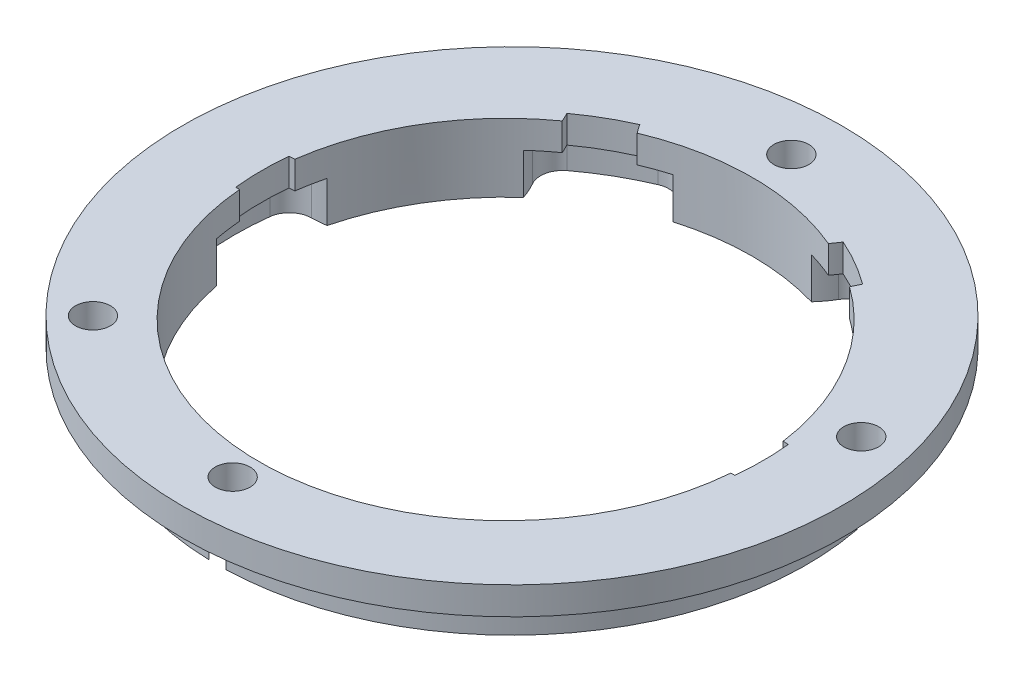
from build123d import *

# Parameters (mm, degrees)
SKETCH1_R           = 6.35
BOSS_EXTRUDE1_DEPTH = 9.652
FILLET1_R           = 2.54
SKETCH2_R           = 33.75
BOSS_EXTRUDE2_DEPTH = 9.652
CUT_EXTRUDE1_DEPTH  = 49.695853067
SKETCH4_R           = 37.75
SKETCH4_R_2         = 33.75
BOSS_EXTRUDE3_DEPTH = 3.175
BOSS_EXTRUDE4_DEPTH = 3.15
CUT_EXTRUDE2_DEPTH  = 61.228214281
SKETCH6_R           = 28.231147361
CUT_EXTRUDE3_DEPTH  = 61.228214281
CUT_EXTRUDE5_DEPTH  = 5


with BuildPart() as part:
    # Sketch1 → Boss-Extrude1 (new body)
    with BuildSketch(Plane(origin=(0, 0, 0), x_dir=(1, 0, 0), z_dir=(0, 1, 0))):
        with BuildLine():
            ThreePointArc((-10.16, 30.080506977), (0, 22.86), (10.16, 30.080506977))
            ThreePointArc((10.16, 30.080506977), (15.875, 27.49630657), (20.970483201, 23.839071591))
            ThreePointArc((20.970483201, 23.839071591), (19.797340731, 11.43), (31.130483201, 6.241435386))
            ThreePointArc((31.130483201, 6.241435386), (31.75, 0), (31.130483201, -6.241435386))
            ThreePointArc((31.130483201, -6.241435386), (19.797340731, -11.43), (20.970483201, -23.839071591))
            ThreePointArc((20.970483201, -23.839071591), (15.875, -27.49630657), (10.16, -30.080506977))
            ThreePointArc((10.16, -30.080506977), (0, -22.86), (-10.16, -30.080506977))
            ThreePointArc((-10.16, -30.080506977), (-15.875, -27.49630657), (-20.970483201, -23.839071591))
            ThreePointArc((-20.970483201, -23.839071591), (-19.797340731, -11.43), (-31.130483201, -6.241435386))
            ThreePointArc((-31.130483201, -6.241435386), (-31.75, 0), (-31.130483201, 6.241435386))
            ThreePointArc((-31.130483201, 6.241435386), (-19.797340731, 11.43), (-20.970483201, 23.839071591))
            ThreePointArc((-20.970483201, 23.839071591), (-15.875, 27.49630657), (-10.16, 30.080506977))
        make_face()
        with Locations(Location((0, 0, 0), (0, 0, 270))):
            Circle(SKETCH1_R, mode=Mode.SUBTRACT)
    extrude(amount=BOSS_EXTRUDE1_DEPTH)

    # Fillet1
    fillet1_edges = [part.edges().sort_by_distance(p)[0] for p in [
        (-10.16, 4.826, -30.080506977),
        (10.16, 4.826, -30.080506977),
        (20.970483201, 4.826, -23.839071591),
        (31.130483201, 4.826, -6.241435386),
        (31.130483201, 4.826, 6.241435386),
        (20.970483201, 4.826, 23.839071591),
        (10.16, 4.826, 30.080506977),
        (-10.16, 4.826, 30.080506977),
        (-20.970483201, 4.826, 23.839071591),
        (-31.130483201, 4.826, 6.241435386),
        (-31.130483201, 4.826, -6.241435386),
        (-20.970483201, 4.826, -23.839071591),
    ]]
    fillet(fillet1_edges, radius=FILLET1_R)

    # Sketch3 → Cut-Extrude1 (cut, through all)
    with BuildSketch(Plane(origin=(0, 9.652, 0), x_dir=(1, 0, 0), z_dir=(0, 1, 0))):
        with BuildLine():
            ThreePointArc((12.454547411, -29.205252076), (15.875, -27.49630657), (19.065216516, -25.388580488))
            ThreePointArc((19.065216516, -25.388580488), (20.026339499, -23.876831986), (19.750712464, -22.106755531))
            ThreePointArc((19.750712464, -22.106755531), (19.797340731, -11.43), (29.020368117, -6.051240971))
            ThreePointArc((29.020368117, -6.051240971), (30.691112811, -5.404902757), (31.519763927, -3.816671587))
            ThreePointArc((31.519763927, -3.816671587), (31.75, 0), (31.519763927, 3.816671587))
            ThreePointArc((31.519763927, 3.816671587), (30.691112811, 5.404902757), (29.020368117, 6.051240971))
            ThreePointArc((29.020368117, 6.051240971), (19.797340731, 11.43), (19.750712464, 22.106755531))
            ThreePointArc((19.750712464, 22.106755531), (20.026339499, 23.876831986), (19.065216516, 25.388580488))
            ThreePointArc((19.065216516, 25.388580488), (15.875, 27.49630657), (12.454547411, 29.205252076))
            ThreePointArc((12.454547411, 29.205252076), (10.664773313, 29.281734744), (9.269655653, 28.157996502))
            ThreePointArc((9.269655653, 28.157996502), (0, 22.86), (-9.269655653, 28.157996502))
            ThreePointArc((-9.269655653, 28.157996502), (-10.664773313, 29.281734744), (-12.454547411, 29.205252076))
            ThreePointArc((-12.454547411, 29.205252076), (-15.875, 27.49630657), (-19.065216516, 25.388580488))
            ThreePointArc((-19.065216516, 25.388580488), (-20.026339499, 23.876831986), (-19.750712464, 22.106755531))
            ThreePointArc((-19.750712464, 22.106755531), (-19.797340731, 11.43), (-29.020368117, 6.051240971))
            ThreePointArc((-29.020368117, 6.051240971), (-30.691112811, 5.404902757), (-31.519763927, 3.816671587))
            ThreePointArc((-31.519763927, 3.816671587), (-31.75, 0), (-31.519763927, -3.816671587))
            ThreePointArc((-31.519763927, -3.816671587), (-30.691112811, -5.404902757), (-29.020368117, -6.051240971))
            ThreePointArc((-29.020368117, -6.051240971), (-19.797340731, -11.43), (-19.750712464, -22.106755531))
            ThreePointArc((-19.750712464, -22.106755531), (-20.026339499, -23.876831986), (-19.065216516, -25.388580488))
            ThreePointArc((-19.065216516, -25.388580488), (-15.875, -27.49630657), (-12.454547411, -29.205252076))
            ThreePointArc((-12.454547411, -29.205252076), (-10.664773313, -29.281734744), (-9.269655653, -28.157996502))
            ThreePointArc((-9.269655653, -28.157996502), (0, -22.86), (9.269655653, -28.157996502))
            ThreePointArc((9.269655653, -28.157996502), (10.664773313, -29.281734744), (12.454547411, -29.205252076))
        make_face()
    extrude(amount=-CUT_EXTRUDE1_DEPTH, mode=Mode.SUBTRACT)


with BuildPart() as body_2:
    # Sketch2 → Boss-Extrude2 (new, through all)
    with BuildSketch(Plane.XZ):
        with Locations(Location((0, 0, 0), (0, 0, 270))):
            Circle(SKETCH2_R)
        with BuildLine():
            ThreePointArc((19.750712464, 22.106755531), (19.797340731, 11.43), (29.020368117, 6.051240971))
            ThreePointArc((29.020368117, 6.051240971), (30.691112811, 5.404902757), (31.519763927, 3.816671587))
            ThreePointArc((31.519763927, 3.816671587), (31.75, 0), (31.519763927, -3.816671587))
            ThreePointArc((31.519763927, -3.816671587), (30.691112811, -5.404902757), (29.020368117, -6.051240971))
            ThreePointArc((29.020368117, -6.051240971), (19.797340731, -11.43), (19.750712464, -22.106755531))
            ThreePointArc((19.750712464, -22.106755531), (20.026339499, -23.876831986), (19.065216516, -25.388580488))
            ThreePointArc((19.065216516, -25.388580488), (15.875, -27.49630657), (12.454547411, -29.205252076))
            ThreePointArc((12.454547411, -29.205252076), (10.664773313, -29.281734744), (9.269655653, -28.157996502))
            ThreePointArc((9.269655653, -28.157996502), (0, -22.86), (-9.269655653, -28.157996502))
            ThreePointArc((-9.269655653, -28.157996502), (-10.664773313, -29.281734744), (-12.454547411, -29.205252076))
            ThreePointArc((-12.454547411, -29.205252076), (-15.875, -27.49630657), (-19.065216516, -25.388580488))
            ThreePointArc((-19.065216516, -25.388580488), (-20.026339499, -23.876831986), (-19.750712464, -22.106755531))
            ThreePointArc((-19.750712464, -22.106755531), (-19.797340731, -11.43), (-29.020368117, -6.051240971))
            ThreePointArc((-29.020368117, -6.051240971), (-30.691112811, -5.404902757), (-31.519763927, -3.816671587))
            ThreePointArc((-31.519763927, -3.816671587), (-31.75, 0), (-31.519763927, 3.816671587))
            ThreePointArc((-31.519763927, 3.816671587), (-30.691112811, 5.404902757), (-29.020368117, 6.051240971))
            ThreePointArc((-29.020368117, 6.051240971), (-19.797340731, 11.43), (-19.750712464, 22.106755531))
            ThreePointArc((-19.750712464, 22.106755531), (-20.026339499, 23.876831986), (-19.065216516, 25.388580488))
            ThreePointArc((-19.065216516, 25.388580488), (-15.875, 27.49630657), (-12.454547411, 29.205252076))
            ThreePointArc((-12.454547411, 29.205252076), (-10.664773313, 29.281734744), (-9.269655653, 28.157996502))
            ThreePointArc((-9.269655653, 28.157996502), (0, 22.86), (9.269655653, 28.157996502))
            ThreePointArc((9.269655653, 28.157996502), (10.664773313, 29.281734744), (12.454547411, 29.205252076))
            ThreePointArc((12.454547411, 29.205252076), (15.875, 27.49630657), (19.065216516, 25.388580488))
            ThreePointArc((19.065216516, 25.388580488), (20.026339499, 23.876831986), (19.750712464, 22.106755531))
        make_face(mode=Mode.SUBTRACT)
    extrude(amount=-BOSS_EXTRUDE2_DEPTH)

    # Sketch4 → Boss-Extrude3 (add)
    # profile 1 of 2: a face of its own
    with BuildSketch(Plane(origin=(0, 9.652, 0), x_dir=(1, 0, 0), z_dir=(0, 1, 0))):
        with Locations(Location((0, 0, 0), (0, 0, 270))):
            Circle(SKETCH4_R)
        with Locations(Location((0, 0, 0), (0, 0, 90))):
            Circle(SKETCH4_R_2, mode=Mode.SUBTRACT)
    # profile 2 of 2: a face of its own
    with BuildSketch(Plane(origin=(0, 9.652, 0), x_dir=(1, 0, 0), z_dir=(0, 1, 0))):
        with Locations(Location((0, 0, 0), (0, 0, 90))):
            Circle(SKETCH4_R_2)
        with BuildLine():
            ThreePointArc((31.519763927, -3.816671587), (30.691112811, -5.404902757), (29.020368117, -6.051240971))
            ThreePointArc((29.020368117, -6.051240971), (19.797340731, -11.43), (19.750712464, -22.106755531))
            ThreePointArc((19.750712464, -22.106755531), (20.026339499, -23.876831986), (19.065216516, -25.388580488))
            ThreePointArc((19.065216516, -25.388580488), (15.875, -27.49630657), (12.454547411, -29.205252076))
            ThreePointArc((12.454547411, -29.205252076), (10.664773313, -29.281734744), (9.269655653, -28.157996502))
            ThreePointArc((9.269655653, -28.157996502), (0, -22.86), (-9.269655653, -28.157996502))
            ThreePointArc((-9.269655653, -28.157996502), (-10.664773313, -29.281734744), (-12.454547411, -29.205252076))
            ThreePointArc((-12.454547411, -29.205252076), (-15.875, -27.49630657), (-19.065216516, -25.388580488))
            ThreePointArc((-19.065216516, -25.388580488), (-20.026339499, -23.876831986), (-19.750712464, -22.106755531))
            ThreePointArc((-19.750712464, -22.106755531), (-19.797340731, -11.43), (-29.020368117, -6.051240971))
            ThreePointArc((-29.020368117, -6.051240971), (-30.691112811, -5.404902757), (-31.519763927, -3.816671587))
            ThreePointArc((-31.519763927, -3.816671587), (-31.75, 0), (-31.519763927, 3.816671587))
            ThreePointArc((-31.519763927, 3.816671587), (-30.691112811, 5.404902757), (-29.020368117, 6.051240971))
            ThreePointArc((-29.020368117, 6.051240971), (-19.797340731, 11.43), (-19.750712464, 22.106755531))
            ThreePointArc((-19.750712464, 22.106755531), (-20.026339499, 23.876831986), (-19.065216516, 25.388580488))
            ThreePointArc((-19.065216516, 25.388580488), (-15.875, 27.49630657), (-12.454547411, 29.205252076))
            ThreePointArc((-12.454547411, 29.205252076), (-10.664773313, 29.281734744), (-9.269655653, 28.157996502))
            ThreePointArc((-9.269655653, 28.157996502), (0, 22.86), (9.269655653, 28.157996502))
            ThreePointArc((9.269655653, 28.157996502), (10.664773313, 29.281734744), (12.454547411, 29.205252076))
            ThreePointArc((12.454547411, 29.205252076), (15.875, 27.49630657), (19.065216516, 25.388580488))
            ThreePointArc((19.065216516, 25.388580488), (20.026339499, 23.876831986), (19.750712464, 22.106755531))
            ThreePointArc((19.750712464, 22.106755531), (19.797340731, 11.43), (29.020368117, 6.051240971))
            ThreePointArc((29.020368117, 6.051240971), (30.691112811, 5.404902757), (31.519763927, 3.816671587))
            ThreePointArc((31.519763927, 3.816671587), (31.75, 0), (31.519763927, -3.816671587))
        make_face(mode=Mode.SUBTRACT)
    extrude(amount=BOSS_EXTRUDE3_DEPTH)

    # Sketch9 → Boss-Extrude4 (add)
    with BuildSketch(Plane(origin=(0, 12.827, 0), x_dir=(1, 0, 0), z_dir=(0, 1, 0))):
        with BuildLine():
            ThreePointArc((-19.065216516, 25.388580488), (-20.026339499, 23.876831986), (-19.750712464, 22.106755531))
            ThreePointArc((-19.750712464, 22.106755531), (-19.797340731, 11.43), (-29.020368117, 6.051240971))
            ThreePointArc((-29.020368117, 6.051240971), (-30.691112811, 5.404902757), (-31.519763927, 3.816671587))
            ThreePointArc((-31.519763927, 3.816671587), (-31.75, 0), (-31.519763927, -3.816671587))
            ThreePointArc((-31.519763927, -3.816671587), (-30.691112811, -5.404902757), (-29.020368117, -6.051240971))
            ThreePointArc((-29.020368117, -6.051240971), (-19.797340731, -11.43), (-19.750712464, -22.106755531))
            ThreePointArc((-19.750712464, -22.106755531), (-20.026339499, -23.876831986), (-19.065216516, -25.388580488))
            ThreePointArc((-19.065216516, -25.388580488), (-15.875, -27.49630657), (-12.454547411, -29.205252076))
            ThreePointArc((-12.454547411, -29.205252076), (-10.664773313, -29.281734744), (-9.269655653, -28.157996502))
            ThreePointArc((-9.269655653, -28.157996502), (0, -22.86), (9.269655653, -28.157996502))
            ThreePointArc((9.269655653, -28.157996502), (10.664773313, -29.281734744), (12.454547411, -29.205252076))
            ThreePointArc((12.454547411, -29.205252076), (15.875, -27.49630657), (19.065216516, -25.388580488))
            ThreePointArc((19.065216516, -25.388580488), (20.026339499, -23.876831986), (19.750712464, -22.106755531))
            ThreePointArc((19.750712464, -22.106755531), (19.797340731, -11.43), (29.020368117, -6.051240971))
            ThreePointArc((29.020368117, -6.051240971), (30.691112811, -5.404902757), (31.519763927, -3.816671587))
            ThreePointArc((31.519763927, -3.816671587), (31.75, 0), (31.519763927, 3.816671587))
            ThreePointArc((31.519763927, 3.816671587), (30.691112811, 5.404902757), (29.020368117, 6.051240971))
            ThreePointArc((29.020368117, 6.051240971), (19.797340731, 11.43), (19.750712464, 22.106755531))
            ThreePointArc((19.750712464, 22.106755531), (20.026339499, 23.876831986), (19.065216516, 25.388580488))
            ThreePointArc((19.065216516, 25.388580488), (15.875, 27.49630657), (12.454547411, 29.205252076))
            ThreePointArc((12.454547411, 29.205252076), (10.664773313, 29.281734744), (9.269655653, 28.157996502))
            ThreePointArc((9.269655653, 28.157996502), (0, 22.86), (-9.269655653, 28.157996502))
            ThreePointArc((-9.269655653, 28.157996502), (-10.664773313, 29.281734744), (-12.454547411, 29.205252076))
            ThreePointArc((-12.454547411, 29.205252076), (-15.875, 27.49630657), (-19.065216516, 25.388580488))
        make_face()
        with BuildLine():
            ThreePointArc((-28.586588604, 3.060956059), (-17.199264519, 9.93), (-16.944160009, 23.226233909))
            ThreePointArc((-16.944160009, 23.226233909), (-14.375, 24.898230359), (-11.642428595, 26.287189968))
            ThreePointArc((-11.642428595, 26.287189968), (0, 19.86), (11.642428595, 26.287189968))
            ThreePointArc((11.642428595, 26.287189968), (14.375, 24.898230359), (16.944160009, 23.226233909))
            ThreePointArc((16.944160009, 23.226233909), (17.199264519, 9.93), (28.586588604, 3.060956059))
            ThreePointArc((28.586588604, 3.060956059), (28.75, 0), (28.586588604, -3.060956059))
            ThreePointArc((28.586588604, -3.060956059), (17.199264519, -9.93), (16.944160009, -23.226233909))
            ThreePointArc((16.944160009, -23.226233909), (14.375, -24.898230359), (11.642428595, -26.287189968))
            ThreePointArc((11.642428595, -26.287189968), (0, -19.86), (-11.642428595, -26.287189968))
            ThreePointArc((-11.642428595, -26.287189968), (-14.375, -24.898230359), (-16.944160009, -23.226233909))
            ThreePointArc((-16.944160009, -23.226233909), (-17.199264519, -9.93), (-28.586588604, -3.060956059))
            ThreePointArc((-28.586588604, -3.060956059), (-28.75, 0), (-28.586588604, 3.060956059))
        make_face(mode=Mode.SUBTRACT)
    extrude(amount=-BOSS_EXTRUDE4_DEPTH)

    # Sketch5 → Cut-Extrude2 (cut, through all)
    with BuildSketch(Plane(origin=(-2.874930527, 12.827, -4.823711209), x_dir=(1, 0, 0), z_dir=(0, 1, 0))):
        with BuildLine():
            ThreePointArc((-21.125069473, -30.823711209), (-19.125069473, -28.823711209), (-21.125069473, -26.823711209))
            ThreePointArc((-21.125069473, -26.823711209), (-23.125069473, -28.823711209), (-21.125069473, -30.823711209))
        make_face()
        with BuildLine():
            ThreePointArc((34.874930527, 5.176288791), (32.874930527, 3.176288791), (34.874930527, 1.176288791))
            ThreePointArc((34.874930527, 1.176288791), (36.874930527, 3.176288791), (34.874930527, 5.176288791))
        make_face()
        with BuildLine():
            ThreePointArc((2.874930527, 29.176288791), (0.874930527, 27.176288791), (2.874930527, 25.176288791))
            ThreePointArc((2.874930527, 25.176288791), (4.874930527, 27.176288791), (2.874930527, 29.176288791))
        make_face()
        with BuildLine():
            ThreePointArc((2.874930527, -38.823711209), (4.874930527, -36.823711209), (2.874930527, -34.823711209))
            ThreePointArc((2.874930527, -34.823711209), (0.874930527, -36.823711209), (2.874930527, -38.823711209))
        make_face()
    extrude(amount=-CUT_EXTRUDE2_DEPTH, mode=Mode.SUBTRACT)

    # Sketch6 → Cut-Extrude3 (cut, through all)
    with BuildSketch(Plane(origin=(-2.874930527, 12.827, -4.823711209), x_dir=(1, 0, 0), z_dir=(0, 1, 0))):
        with Locations((2.874930527, -5.55485857)):
            Circle(SKETCH6_R)
    extrude(amount=-CUT_EXTRUDE3_DEPTH, mode=Mode.SUBTRACT)

    # Sketch8 → Cut-Extrude5 (cut)
    with BuildSketch(Plane.XZ):
        with BuildLine():
            ThreePointArc((-25.226732576, 22.42040284), (-22.585786438, 22.585786438), (-22.42040284, 25.226732576))
            ThreePointArc((-22.42040284, 25.226732576), (-12.456354606, 31.367207876), (-0.994261009, 33.735351562))
            ThreePointArc((-0.994261009, 33.735351562), (0, 30), (0.994261009, 33.735351563))
            ThreePointArc((0.994261009, 33.735351563), (26.330466184, 21.113243486), (33.145258747, -6.360371261))
            ThreePointArc((33.145258747, -6.360371261), (30.059715, -7.51492875), (32.238932429, -9.985676533))
            ThreePointArc((32.238932429, -9.985676533), (20.423590589, -26.868930896), (0.994261009, -33.735351562))
            ThreePointArc((0.994261009, -33.735351562), (0, -30), (-0.994261009, -33.735351562))
            ThreePointArc((-0.994261009, -33.735351562), (-30.987938207, -13.371992585), (-25.226732576, 22.42040284))
        make_face()
    extrude(amount=-CUT_EXTRUDE5_DEPTH, mode=Mode.SUBTRACT)


solid = body_2.part
